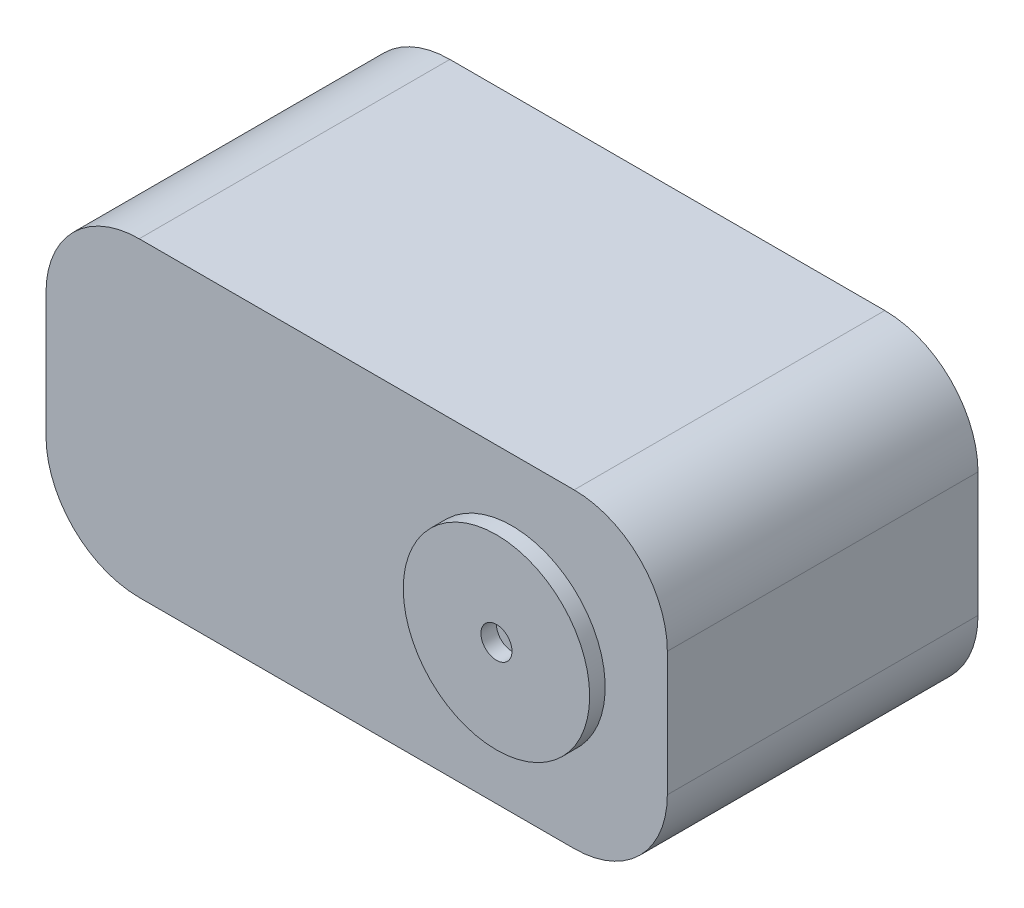
from build123d import *

# Parameters (mm, degrees)
BOSS_EXTRUDE1_DEPTH = 25.4
SKETCH2_R           = 7.62
BOSS_EXTRUDE2_DEPTH = 1.27
SKETCH3_R           = 1.27
CUT_EXTRUDE1_DEPTH  = 1.27


with BuildPart() as part:
    # Sketch1 → Boss-Extrude1 (new body)
    with BuildSketch(Plane.XY):
        with BuildLine():
            Line((-17.78, 12.7), (17.78, 12.7))
            ThreePointArc((17.78, 12.7), (23.168153673, 10.468153673), (25.4, 5.08))
            Line((25.4, 5.08), (25.4, -5.08))
            ThreePointArc((25.4, -5.08), (23.168153673, -10.468153673), (17.78, -12.7))
            Line((17.78, -12.7), (-17.78, -12.7))
            ThreePointArc((-17.78, -12.7), (-23.168153673, -10.468153673), (-25.4, -5.08))
            Line((-25.4, -5.08), (-25.4, 5.08))
            ThreePointArc((-25.4, 5.08), (-23.168153673, 10.468153673), (-17.78, 12.7))
        make_face()
    extrude(amount=BOSS_EXTRUDE1_DEPTH)

    # Sketch2 → Boss-Extrude2 (add)
    with BuildSketch(Plane.XY.offset(25.4)):
        with Locations(Location((12.7, 0, 0), (0, 0, 180))):
            Circle(SKETCH2_R)
    extrude(amount=BOSS_EXTRUDE2_DEPTH)

    # Sketch3 → Cut-Extrude1 (cut)
    with BuildSketch(Plane.XY.offset(26.67)):
        with Locations((12.7, 0)):
            Circle(SKETCH3_R)
    extrude(amount=-CUT_EXTRUDE1_DEPTH, mode=Mode.SUBTRACT)


solid = part.part
